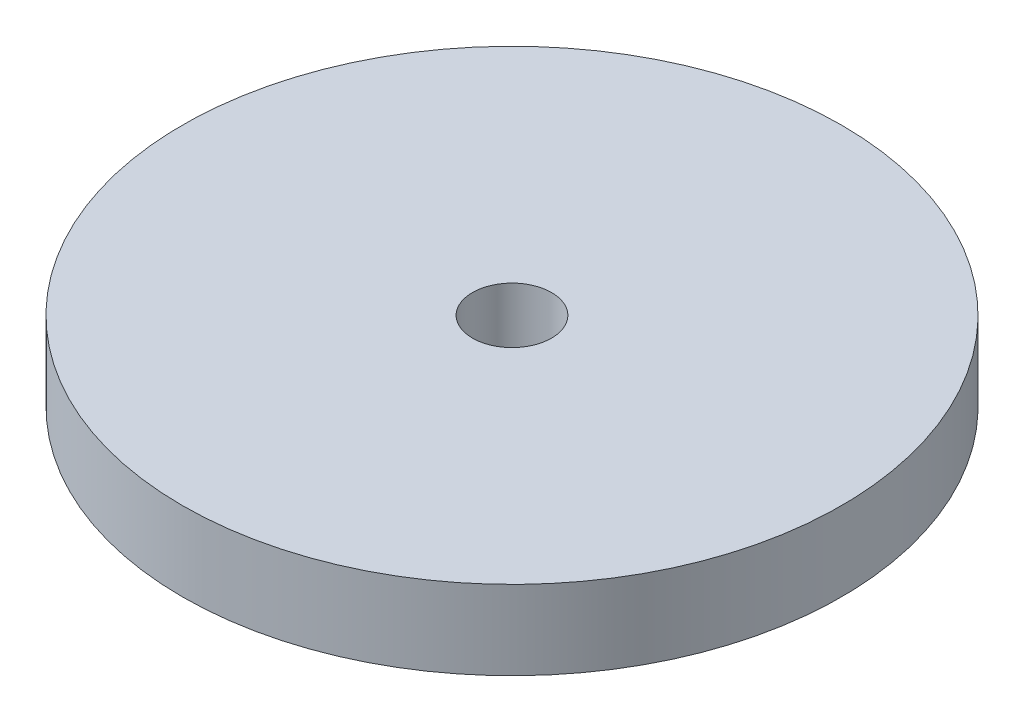
from build123d import *

# Parameters (mm, degrees)
SCHIZZO1_R                   = 12.5
SCHIZZO1_R_2                 = 1.5
ESTRUSIONE_ESTRUSIONE1_DEPTH = 3


with BuildPart() as part:
    # Schizzo1 → Estrusione-Estrusione1 (new body)
    with BuildSketch(Plane(origin=(0, 0, 0), x_dir=(1, 0, 0), z_dir=(0, 1, 0))):
        with Locations(Location((0, 0, 0), (0, 0, 270))):
            Circle(SCHIZZO1_R)
        with Locations(Location((0, 0, 0), (0, 0, 270))):
            Circle(SCHIZZO1_R_2, mode=Mode.SUBTRACT)
    extrude(amount=ESTRUSIONE_ESTRUSIONE1_DEPTH)


solid = part.part
